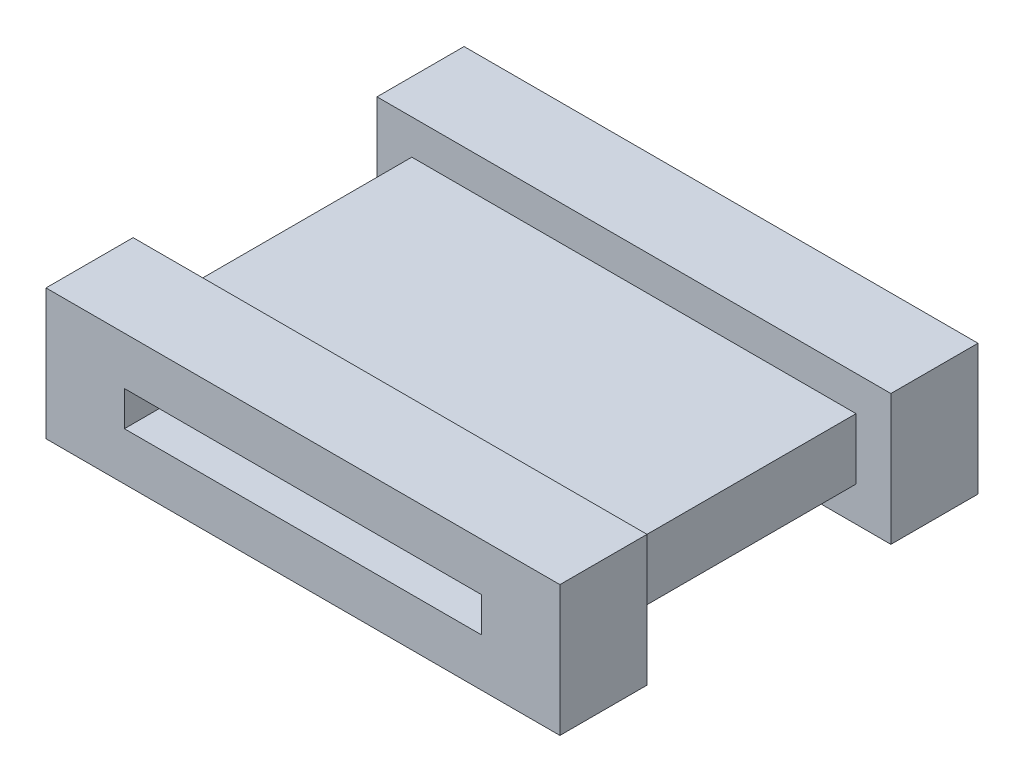
from build123d import *

# Parameters (mm, degrees)
BOSS_EXTRUDE1_DEPTH      = 7.5
BOSS_EXTRUDE1_DEPTH_BACK = 7.5
SKETCH1_W                = 59
SKETCH1_H                = 48
SKETCH2_W                = 41
SKETCH2_H                = 4
CUT_EXTRUDE1_DEPTH       = 57.837487629
SKETCH3_W                = 59
SKETCH3_H                = 28
CUT_EXTRUDE2_DEPTH       = 4
SKETCH4_W                = 28
SKETCH4_H                = 11
CUT_EXTRUDE3_DEPTH       = 4


with BuildPart() as part:
    # Sketch1 → Boss-Extrude1 (new, two sides: drawn at the far end of the back side and taken through both)
    with BuildSketch(Plane(origin=(0, 0, 0), x_dir=(1, 0, 0), z_dir=(0, 1, 0)).offset(-BOSS_EXTRUDE1_DEPTH_BACK)):
        Rectangle(SKETCH1_W, SKETCH1_H)
    extrude(amount=BOSS_EXTRUDE1_DEPTH + BOSS_EXTRUDE1_DEPTH_BACK)

    # Sketch2 → Cut-Extrude1 (cut, through all)
    with BuildSketch(Plane.XY.offset(24)):
        Rectangle(SKETCH2_W, SKETCH2_H)
    extrude(amount=-CUT_EXTRUDE1_DEPTH, mode=Mode.SUBTRACT)

    # Sketch3 → Cut-Extrude2 (cut)
    with BuildSketch(Plane(origin=(0, 7.5, 0), x_dir=(1, 0, 0), z_dir=(0, 1, 0))):
        Rectangle(SKETCH3_W, SKETCH3_H)
    cut_extrude2 = extrude(amount=-CUT_EXTRUDE2_DEPTH, mode=Mode.SUBTRACT)

    # Sketch4 → Cut-Extrude3 (cut)
    with BuildSketch(Plane.ZY.offset(29.5)):
        with Locations((0, -2)):
            Rectangle(SKETCH4_W, SKETCH4_H)
    cut_extrude3 = extrude(amount=-CUT_EXTRUDE3_DEPTH, mode=Mode.SUBTRACT)

    # Mirror1: Cut-Extrude3 across plane
    add(cut_extrude3.mirror(Plane(origin=(0, 0, 0), x_dir=(0, 0, 1), z_dir=(1, 0, 0))), mode=Mode.SUBTRACT)

    # Mirror2: Cut-Extrude2 across plane
    add(cut_extrude2.mirror(Plane.ZX), mode=Mode.SUBTRACT)


solid = part.part
